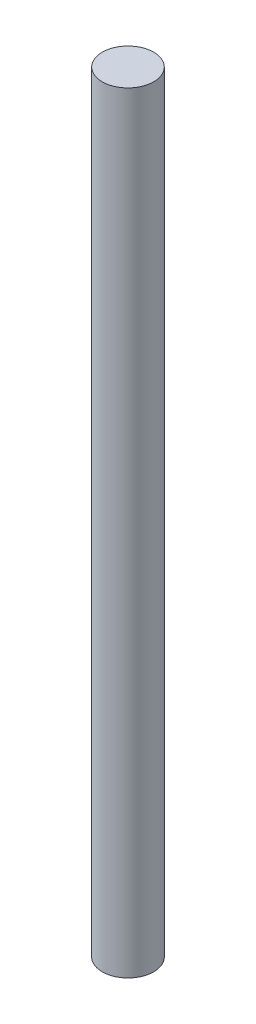
from build123d import *

# Parameters (mm, degrees)
SKETCH1_R           = 10
BOSS_EXTRUDE1_DEPTH = 300
SKETCH2_R           = 2
CUT_EXTRUDE1_DEPTH  = 300


with BuildPart() as part:
    # Sketch1 → Boss-Extrude1 (new body)
    with BuildSketch(Plane(origin=(0, 0, 0), x_dir=(1, 0, 0), z_dir=(0, 1, 0))):
        with Locations(Location((0, 0, 0), (0, 0, 270))):
            Circle(SKETCH1_R)
    extrude(amount=-BOSS_EXTRUDE1_DEPTH)

    # Sketch2 → Cut-Extrude1 (cut)
    with BuildSketch(Plane.XY):
        with Locations((0, -22.379139511)):
            Circle(SKETCH2_R)
    extrude(amount=-CUT_EXTRUDE1_DEPTH, mode=Mode.SUBTRACT)


solid = part.part
